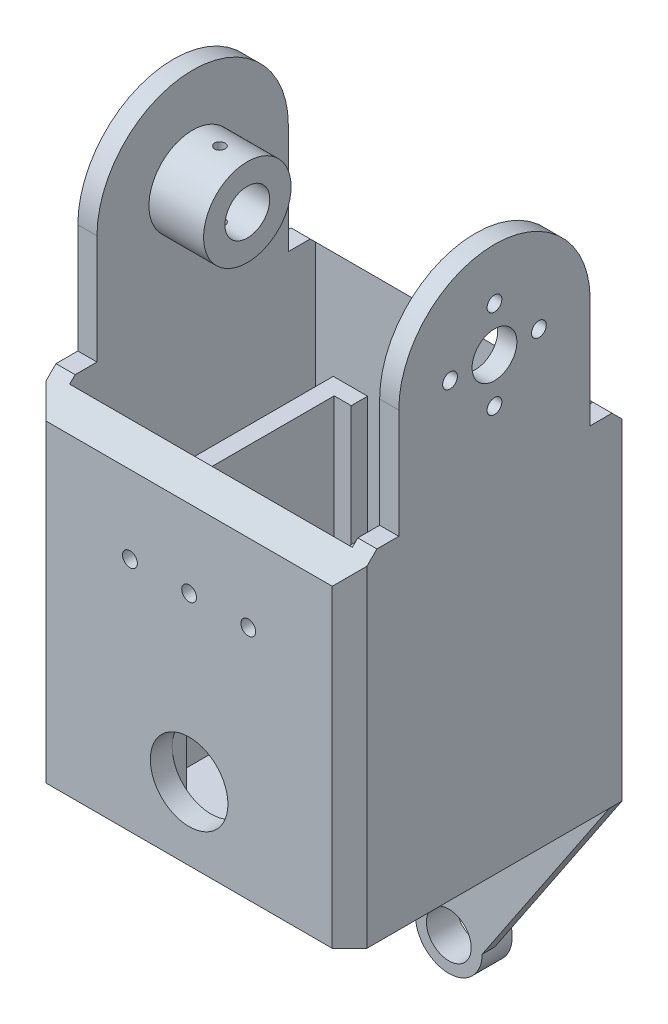
from build123d import *

# Parameters (mm, degrees)
SKETCH1_R                = 4.1
BOSS_EXTRUDE1_DEPTH      = 3.5
BOSS_EXTRUDE2_DEPTH      = 51.7
BOSS_EXTRUDE2_DEPTH_BACK = 3.5
CHAMFER2_SIZE            = 5
CUT_EXTRUDE1_REACH       = 112.079
SKETCH4_W                = 51.7
SKETCH4_H                = 45
BOSS_EXTRUDE3_START      = 3.5
SKETCH5_R                = 4.1
BOSS_EXTRUDE3_DEPTH      = 3.5
CUT_EXTRUDE3_REACH       = 104.062
SKETCH9_R                = 1.35
SKETCH10_W               = 58.7
SKETCH10_H               = 53
BOSS_EXTRUDE5_DEPTH      = 3.175
SKETCH26_R               = 7.1
CUT_EXTRUDE6_DEPTH       = 4
SKETCH27_W               = 3.175
SKETCH27_H               = 34.600130378
BOSS_EXTRUDE6_DEPTH      = 45.22
SKETCH29_R               = 4.1
BOSS_EXTRUDE8_DEPTH      = 5.5
CHAMFER3_SIZE            = 3.175
BOSS_EXTRUDE9_START      = 10
SKETCH30_R               = 8
SKETCH30_R_2             = 4.1
BOSS_EXTRUDE9_DEPTH      = 10
SKETCH31_R               = 0.95
CUT_EXTRUDE7_DEPTH       = 120.972242206
BOSS_EXTRUDE10_DEPTH     = 45.22
SKETCH33_W               = 5.386290257
SKETCH33_H               = 2.7
BOSS_EXTRUDE11_DEPTH     = 45.22
BOSS_EXTRUDE12_DEPTH     = 0.2
SKETCH35_R               = 1.35
CUT_EXTRUDE8_DEPTH       = 5


with BuildPart() as part:
    # Sketch1 → Boss-Extrude1 (new body)
    with BuildSketch(Plane(origin=(0, 0, 0), x_dir=(0, 0, -1), z_dir=(1, 0, 0))):
        with BuildLine():
            Line((-17.5, 0), (-17.5, -20))
            Line((-17.5, -20), (-22.5, -20))
            Line((-22.5, -20), (-22.5, -76))
            Line((-22.5, -76), (22.5, -76))
            Line((22.5, -76), (22.5, -20))
            Line((22.5, -20), (17.5, -20))
            Line((17.5, -20), (17.5, 0))
            ThreePointArc((17.5, 0), (0, 17.5), (-17.5, 0))
        make_face()
        Circle(SKETCH1_R, mode=Mode.SUBTRACT)
    extrude(amount=-BOSS_EXTRUDE1_DEPTH)

    # Sketch2 → Boss-Extrude2 (add, two sides: drawn at the far end of the back side and taken through both)
    with BuildSketch(Plane(origin=(0, 0, 0), x_dir=(0, 0, -1), z_dir=(1, 0, 0)).offset(-BOSS_EXTRUDE2_DEPTH_BACK)):
        Polygon((-22.5, -20), (-22.5, -76), (22.5, -76), (22.5, -20), (26.5, -20), (26.5, -79.175), (-26.5, -79.175), (-26.5, -20), align=None)
    extrude(amount=BOSS_EXTRUDE2_DEPTH + BOSS_EXTRUDE2_DEPTH_BACK)

    # Chamfer2
    chamfer2_edges = [part.edges().sort_by_distance(p)[0] for p in [
        (24.1, -20, -26.5),
        (24.1, -20, 26.5),
    ]]
    chamfer(chamfer2_edges, length=CHAMFER2_SIZE)

    # Sketch4 → Cut-Extrude1 (cut, up to next)
    with BuildSketch(Plane(origin=(0, -76, 0), x_dir=(1, 0, 0), z_dir=(0, 1, 0)), mode=Mode.PRIVATE) as cut_extrude1_sk1:
        with Locations((25.85, 0)):
            Rectangle(SKETCH4_W, SKETCH4_H)
    cut_extrude1_tool1 = extrude(cut_extrude1_sk1.sketch, amount=-CUT_EXTRUDE1_REACH, mode=Mode.PRIVATE) & part.part
    add(cut_extrude1_tool1.solids().sort_by_distance((25.85, -76, 0))[0], mode=Mode.SUBTRACT)

    # Sketch5 → Boss-Extrude3 (add)
    with BuildSketch(Plane(origin=(51.7, 0, 0), x_dir=(0, 0, -1), z_dir=(1, 0, 0)).offset(BOSS_EXTRUDE3_START)):
        with BuildLine():
            Line((21.5, -20), (17.5, -20))
            Line((17.5, -20), (17.5, 0))
            ThreePointArc((17.5, 0), (0, 17.5), (-17.5, 0))
            Line((-17.5, 0), (-17.5, -20))
            Line((-17.5, -20), (-21.5, -20))
            Line((-21.5, -20), (-26.5, -25))
            Line((-26.5, -25), (-26.5, -79.175))
            Line((-26.5, -79.175), (26.5, -79.175))
            Line((26.5, -79.175), (26.5, -25))
            Line((26.5, -25), (21.5, -20))
        make_face()
        Circle(SKETCH5_R, mode=Mode.SUBTRACT)
    extrude(amount=-BOSS_EXTRUDE3_DEPTH)

    # Sketch9 → Cut-Extrude3 (cut, up to next)
    with BuildSketch(Plane(origin=(55.2, 0, 0), x_dir=(0, 0, -1), z_dir=(1, 0, 0)), mode=Mode.PRIVATE) as cut_extrude3_sk1:
        with Locations((0, 8.125)):
            Circle(SKETCH9_R)
    cut_extrude3_tool1 = extrude(cut_extrude3_sk1.sketch, amount=-CUT_EXTRUDE3_REACH, mode=Mode.PRIVATE) & part.part
    # Sketch9 → Cut-Extrude3 (cut, up to next)
    with BuildSketch(Plane(origin=(55.2, 0, 0), x_dir=(0, 0, -1), z_dir=(1, 0, 0)), mode=Mode.PRIVATE) as cut_extrude3_sk2:
        with Locations((8.125, 0)):
            Circle(SKETCH9_R)
    cut_extrude3_tool2 = extrude(cut_extrude3_sk2.sketch, amount=-CUT_EXTRUDE3_REACH, mode=Mode.PRIVATE) & part.part
    # Sketch9 → Cut-Extrude3 (cut, up to next)
    with BuildSketch(Plane(origin=(55.2, 0, 0), x_dir=(0, 0, -1), z_dir=(1, 0, 0)), mode=Mode.PRIVATE) as cut_extrude3_sk3:
        with Locations((0, -8.125)):
            Circle(SKETCH9_R)
    cut_extrude3_tool3 = extrude(cut_extrude3_sk3.sketch, amount=-CUT_EXTRUDE3_REACH, mode=Mode.PRIVATE) & part.part
    # Sketch9 → Cut-Extrude3 (cut, up to next)
    with BuildSketch(Plane(origin=(55.2, 0, 0), x_dir=(0, 0, -1), z_dir=(1, 0, 0)), mode=Mode.PRIVATE) as cut_extrude3_sk4:
        with Locations((-8.125, 0)):
            Circle(SKETCH9_R)
    cut_extrude3_tool4 = extrude(cut_extrude3_sk4.sketch, amount=-CUT_EXTRUDE3_REACH, mode=Mode.PRIVATE) & part.part
    add(cut_extrude3_tool1.solids().sort_by_distance((55.2, 8.125, 0))[0], mode=Mode.SUBTRACT)
    add(cut_extrude3_tool2.solids().sort_by_distance((55.2, 0, -8.125))[0], mode=Mode.SUBTRACT)
    add(cut_extrude3_tool3.solids().sort_by_distance((55.2, -8.125, 0))[0], mode=Mode.SUBTRACT)
    add(cut_extrude3_tool4.solids().sort_by_distance((55.2, 0, 8.125))[0], mode=Mode.SUBTRACT)

    # Sketch10 → Boss-Extrude5 (add)
    with BuildSketch(Plane.XZ.offset(79.175)):
        with Locations((25.85, 0)):
            Rectangle(SKETCH10_W, SKETCH10_H)
    extrude(amount=BOSS_EXTRUDE5_DEPTH)

    # Sketch26 → Cut-Extrude6 (cut)
    with BuildSketch(Plane.XY.offset(26.5)):
        with Locations((25.85, -69.065)):
            Circle(SKETCH26_R)
    extrude(amount=-CUT_EXTRUDE6_DEPTH, mode=Mode.SUBTRACT)

    # Sketch27 → Boss-Extrude6 (add)
    with BuildSketch(Plane(origin=(0, -79.175, 0), x_dir=(1, 0, 0), z_dir=(0, 1, 0))):
        with Locations((39.993724488, -5.199934811)):
            Rectangle(SKETCH27_W, SKETCH27_H)
        with Locations((11.706275512, -5.199934811)):
            Rectangle(SKETCH27_W, SKETCH27_H)
    extrude(amount=BOSS_EXTRUDE6_DEPTH)

    # Sketch29 → Boss-Extrude8 (add)
    with BuildSketch(Plane(origin=(0, 0, -26.5), x_dir=(-1, 0, 0), z_dir=(0, 0, -1))):
        with BuildLine():
            Line((-40.997321429, -82.35), (-55.2, -82.35))
            Line((-55.2, -82.35), (-31.95, -117.07))
            ThreePointArc((-31.95, -117.07), (-25.85, -123.17), (-19.75, -117.07))
            Line((-19.75, -117.07), (3.5, -82.35))
            Line((3.5, -82.35), (-10.702678571, -82.35))
            Line((-10.702678571, -82.35), (-10.702678571, -88.35))
            Line((-10.702678571, -88.35), (-20.85, -103.503333333))
            Line((-20.85, -103.503333333), (-30.85, -103.503333333))
            Line((-30.85, -103.503333333), (-40.997321429, -88.35))
            Line((-40.997321429, -88.35), (-40.997321429, -82.35))
        make_face()
        with Locations(Location((-25.85, -117.07, 0), (0, 0, 90))):
            Circle(SKETCH29_R, mode=Mode.SUBTRACT)
    extrude(amount=-BOSS_EXTRUDE8_DEPTH)

    # Chamfer3
    chamfer3_edges = [part.edges().sort_by_distance(p)[0] for p in [
        (43.575, -99.71, -26.5),
        (8.125, -99.71, -26.5),
        (-3.5, -53.675, -26.5),
        (-3.5, -53.675, 26.5),
        (55.2, -53.675, 26.5),
        (55.2, -53.675, -26.5),
    ]]
    chamfer(chamfer3_edges, length=CHAMFER3_SIZE)

    # Sketch30 → Boss-Extrude9 (add)
    with BuildSketch(Plane(origin=(0, 0, 0), x_dir=(0, 0, -1), z_dir=(1, 0, 0)).offset(BOSS_EXTRUDE9_START)):
        Circle(SKETCH30_R)
        Circle(SKETCH30_R_2, mode=Mode.SUBTRACT)
    extrude(amount=-BOSS_EXTRUDE9_DEPTH)

    # Sketch31 → Cut-Extrude7 (cut, through all)
    with BuildSketch(Plane(origin=(0, -20, 0), x_dir=(1, 0, 0), z_dir=(0, 1, 0))):
        with Locations(Location((5, 0, 0), (0, 0, 90))):
            Circle(SKETCH31_R)
    extrude(amount=CUT_EXTRUDE7_DEPTH, mode=Mode.SUBTRACT)

    # Sketch32 → Boss-Extrude10 (add)
    with BuildSketch(Plane(origin=(0, -79.175, 0), x_dir=(1, 0, 0), z_dir=(0, 1, 0))):
        Polygon((13.293775512, 12.600036526), (16.4, 12.600036526), (16.4, 15.600130378), (10.118775512, 15.600130378), (10.118775512, 12.100130378), (13.293775512, 12.100130378), align=None)
    boss_extrude10 = extrude(amount=BOSS_EXTRUDE10_DEPTH)

    # Sketch33 → Boss-Extrude11 (add)
    with BuildSketch(Plane(origin=(0, -79.175, 0), x_dir=(1, 0, 0), z_dir=(0, 1, 0))):
        with Locations((15.986920641, -21.15)):
            Rectangle(SKETCH33_W, SKETCH33_H)
    boss_extrude11 = extrude(amount=BOSS_EXTRUDE11_DEPTH)

    # Mirror1: Boss-Extrude10, Boss-Extrude11 across plane
    add(boss_extrude10.mirror(Plane.ZY.offset(-25.85)))
    add(boss_extrude11.mirror(Plane.ZY.offset(-25.85)))

    # Sketch34 → Boss-Extrude12 (add)
    with BuildSketch(Plane(origin=(0, -33.955, 0), x_dir=(1, 0, 0), z_dir=(0, 1, 0))):
        Polygon((13.293775512, -19.8), (13.293775512, 12.600036526), (16.4, 12.600036526), (16.4, 15.600130378), (10.118775512, 15.600130378), (10.118775512, -22.5), (18.680065769, -22.5), (18.680065769, -19.8), align=None)
        Polygon((41.581224488, -22.5), (41.581224488, 15.600130378), (35.3, 15.600130378), (35.3, 12.600036526), (38.406224488, 12.600036526), (38.406224488, -19.8), (33.019934231, -19.8), (33.019934231, -22.5), align=None)
    extrude(amount=BOSS_EXTRUDE12_DEPTH)

    # Sketch35 → Cut-Extrude8 (cut)
    with BuildSketch(Plane.XY.offset(26.5)):
        with Locations((36.668603525, -39.204067417)):
            Circle(SKETCH35_R)
        with Locations((25.849997965, -39.204067417)):
            Circle(SKETCH35_R)
        with Locations((15.031392404, -39.204067417)):
            Circle(SKETCH35_R)
    extrude(amount=-CUT_EXTRUDE8_DEPTH, mode=Mode.SUBTRACT)


solid = part.part
